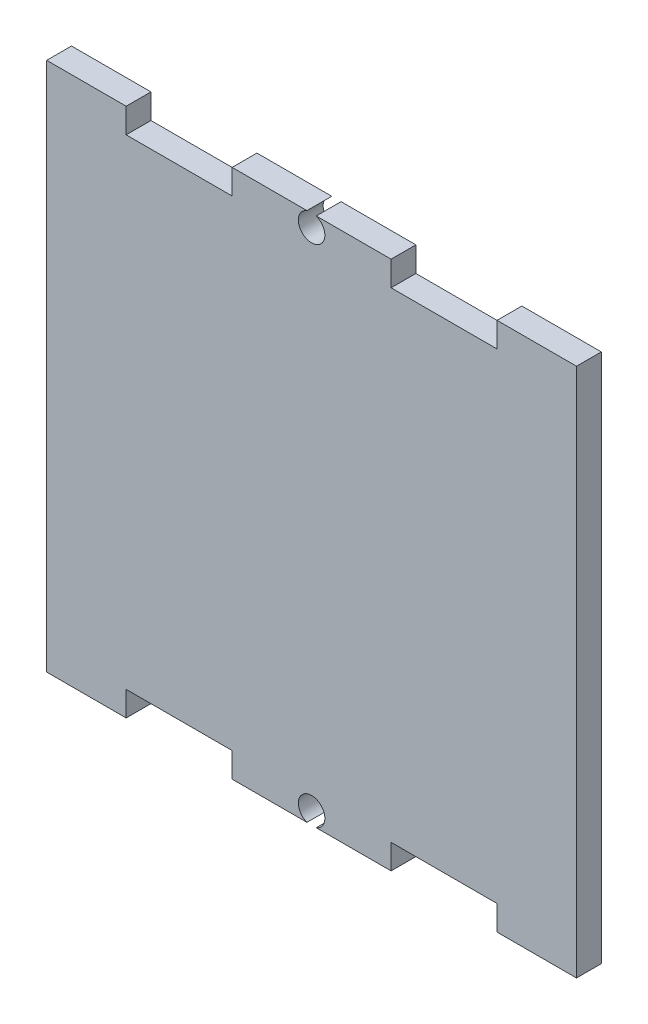
from build123d import *

# Parameters (mm, degrees)
SKETCH1_W           = 63.5
SKETCH1_H           = 63.5
BOSS_EXTRUDE1_DEPTH = 2.9718
SKETCH2_R           = 1.5875
SKETCH2_W           = 12.7
SKETCH2_H           = 2.9718
CUT_EXTRUDE1_DEPTH  = 45.999517722


with BuildPart() as part:
    # Sketch1 → Boss-Extrude1 (new body)
    with BuildSketch(Plane.XY):
        Rectangle(SKETCH1_W, SKETCH1_H)
    extrude(amount=BOSS_EXTRUDE1_DEPTH)

    # Sketch2 → Cut-Extrude1 (cut, through all)
    with BuildSketch(Plane.XY.offset(2.9718)):
        with Locations((0, -30.2641)):
            Circle(SKETCH2_R)
        with Locations((0, 30.2641)):
            Circle(SKETCH2_R)
        with Locations((15.875, -30.2641)):
            Rectangle(SKETCH2_W, SKETCH2_H)
        with Locations((-15.875, -30.2641)):
            Rectangle(SKETCH2_W, SKETCH2_H)
        with Locations((15.875, 30.2641)):
            Rectangle(SKETCH2_W, SKETCH2_H)
        with Locations((-15.875, 30.2641)):
            Rectangle(SKETCH2_W, SKETCH2_H)
    extrude(amount=-CUT_EXTRUDE1_DEPTH, mode=Mode.SUBTRACT)


solid = part.part
